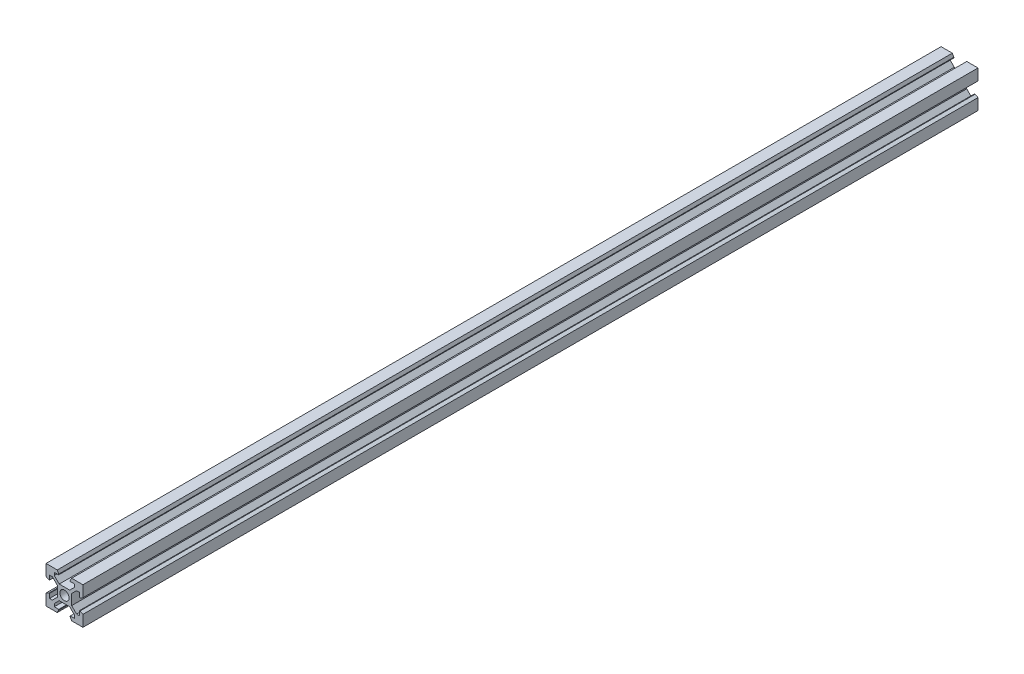
from build123d import *

# Parameters (mm, degrees)
SKETCH1_R           = 2.5
BOSS_EXTRUDE1_DEPTH = 485


with BuildPart() as part:
    # Sketch1 → Boss-Extrude1 (new body)
    with BuildSketch(Plane.XY):
        Polygon((6.1, 20), (0, 20), (0, 13.895792909), (1.56, 13.1), (1.9, 13.1), (1.9, 15.5), (3.439339828, 15.5), (6.1, 12.839339828), (6.1, 7.160660172), (3.439339828, 4.5), (1.9, 4.5), (1.9, 6.9), (1.56, 6.9), (0, 6.104207091), (0, 0), (6.1, 0), (6.9, 1.56), (6.9, 1.9), (4.5, 1.9), (4.5, 3.439339828), (7.160660172, 6.1), (12.839339828, 6.1), (15.5, 3.439339828), (15.5, 1.9), (13.1, 1.9), (13.1, 1.56), (13.9, 0), (20, 0), (20, 6.104207091), (18.44, 6.9), (18.1, 6.9), (18.1, 4.5), (16.560660172, 4.5), (13.9, 7.160660172), (13.9, 12.839339828), (16.560660172, 15.5), (18.1, 15.5), (18.1, 13.1), (18.44, 13.1), (20, 13.895792909), (20, 20), (13.9, 20), (13.1, 18.44), (13.1, 18.1), (15.5, 18.1), (15.5, 16.560660172), (12.839339828, 13.9), (7.160660172, 13.9), (4.5, 16.560660172), (4.5, 18.1), (6.9, 18.1), (6.9, 18.44), align=None)
        with Locations((10, 10)):
            Circle(SKETCH1_R, mode=Mode.SUBTRACT)
    extrude(amount=BOSS_EXTRUDE1_DEPTH)


solid = part.part
